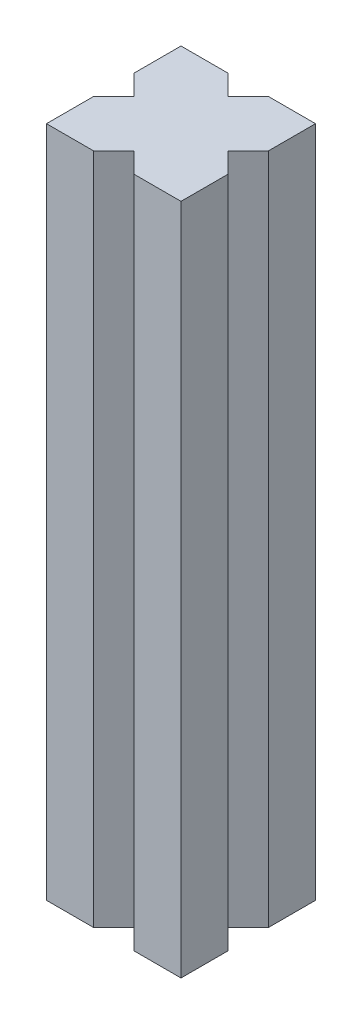
from build123d import *

# Parameters (mm, degrees)
SKIZZE1_W                       = 20
SKIZZE1_H                       = 20
AUFSATZ_LINEAR_AUSTRAGEN1_DEPTH = 100
SCHNITT_LINEAR_AUSTRAGEN1_DEPTH = 104.923048454


with BuildPart() as part:
    # Skizze1 → Aufsatz-Linear austragen1 (new body)
    with BuildSketch(Plane(origin=(0, 0, 0), x_dir=(1, 0, 0), z_dir=(0, 1, 0))):
        with Locations((10, 10)):
            Rectangle(SKIZZE1_W, SKIZZE1_H)
    extrude(amount=AUFSATZ_LINEAR_AUSTRAGEN1_DEPTH)

    # Skizze2 → Schnitt-Linear austragen1 (cut, through all)
    with BuildSketch(Plane(origin=(0, 100, 0), x_dir=(1, 0, 0), z_dir=(0, 1, 0))):
        Polygon((7, 20), (10, 17), (13, 20), align=None)
        Polygon((20, 13), (17, 10), (20, 7), align=None)
        Polygon((0, 7), (0, 13), (3, 10), align=None)
        Polygon((7, 0), (13, 0), (10, 3), align=None)
    extrude(amount=-SCHNITT_LINEAR_AUSTRAGEN1_DEPTH, mode=Mode.SUBTRACT)


solid = part.part
